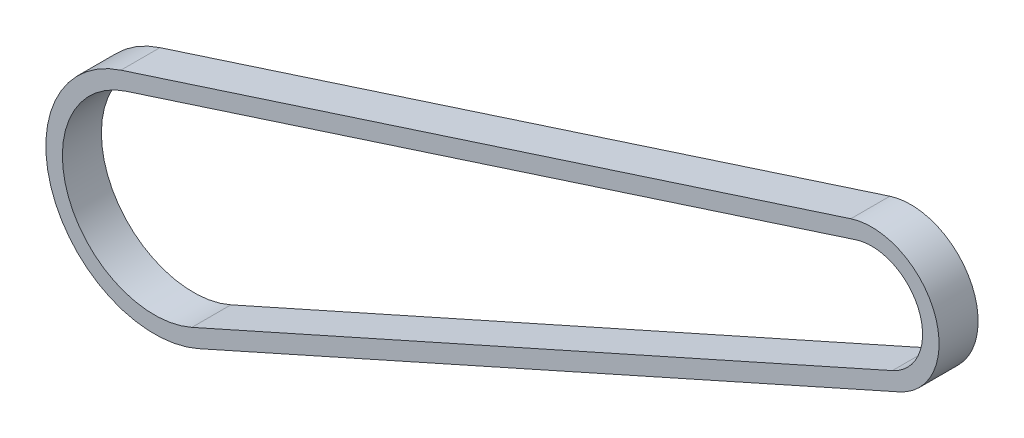
from build123d import *

# Parameters (mm, degrees)
EXTRUDE_THIN1_DEPTH = 4.500000017


with BuildPart() as part:
    # Sketch2 → Extrude-Thin1 (new, symmetric)
    with BuildSketch(Plane.XY):
        with BuildLine():
            Line((-173.119518367, -39.681895968), (-4.793022489, 14.806647851))
            ThreePointArc((-4.793022489, 14.806647851), (14.529399643, 5.577313974), (6.345671393, -14.210641777))
            Line((6.345671393, -14.210641777), (-155.205245375, -86.350172644))
            ThreePointArc((-155.205245375, -86.350172644), (-188.778456493, -72.465260037), (-173.119518367, -39.681895968))
        make_face()
        with BuildLine():
            Line((-171.946138829, -43.30671051), (-3.619642951, 11.181833309))
            ThreePointArc((-3.619642951, 11.181833309), (10.972458218, 4.211932086), (4.792187973, -10.731735446))
            Line((4.792187973, -10.731735446), (-156.758728795, -82.871266312))
            ThreePointArc((-156.758728795, -82.871266312), (-185.221515068, -71.099878149), (-171.946138829, -43.30671051))
        make_face(mode=Mode.SUBTRACT)
    extrude(amount=EXTRUDE_THIN1_DEPTH, both=True)


solid = part.part
